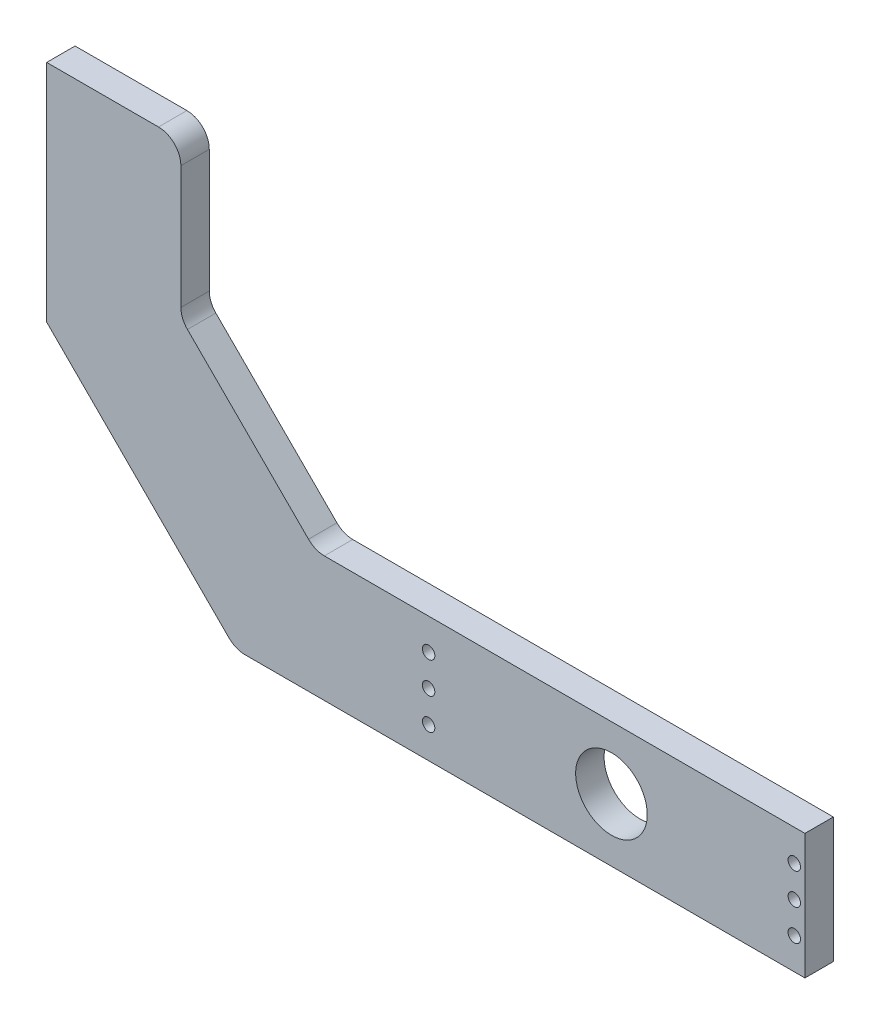
from build123d import *

# Parameters (mm, degrees)
RESSALTO_EXTRUS_O1_DEPTH = 12.7
CIRCULO_ROLAMENTO_REACH  = 245.52
ESBO_O3_R                = 16
ESBO_O6_R                = 2.5
CORTE_EXTRUS_O4_DEPTH    = 30
CORTE_EXTRUS_O6_REACH    = 245.52
CORTE_EXTRUS_O7_REACH    = 245.52
ESBO_O10_R               = 2.78
CORTE_EXTRUS_O8_REACH    = 245.52
ESBO_O12_R               = 2.78
FILETE1_R                = 10


with BuildPart() as part:
    # Esboço1 → Ressalto-extrusão1 (new body)
    with BuildSketch(Plane.XY):
        Polygon((-114.28595772, -92.023971813), (224.71404228, -92.023971813), (224.71404228, -36.023971813), (5.71404228, -36.023971813), (-54.28595772, 23.976028187), (-54.28595772, 92.976028187), (-114.28595772, 92.976028187), align=None)
    extrude(amount=RESSALTO_EXTRUS_O1_DEPTH)

    # Esboço3 → Circulo rolamento (cut, up to next)
    with BuildSketch(Plane.XY.offset(12.7), mode=Mode.PRIVATE) as circulo_rolamento_sk1:
        with Locations((138.21404228, -64.023971813)):
            Circle(ESBO_O3_R)
    circulo_rolamento_tool1 = extrude(circulo_rolamento_sk1.sketch, amount=-CIRCULO_ROLAMENTO_REACH, mode=Mode.PRIVATE) & part.part
    add(circulo_rolamento_tool1.solids().sort_by_distance((138.214042, -64.023972, 12.7))[0], mode=Mode.SUBTRACT)

    # Esboço6 → Corte-extrusão4 (cut)
    with BuildSketch(Plane.ZY.offset(114.28595772)):
        with Locations(Location((7.9, 67.976028187, 0), (0, 0, 270))):
            Circle(ESBO_O6_R)
        with Locations(Location((7.9, 42.976028187, 0), (0, 0, 270))):
            Circle(ESBO_O6_R)
        with Locations(Location((7.9, 17.976028187, 0), (0, 0, 270))):
            Circle(ESBO_O6_R)
    extrude(amount=-CORTE_EXTRUS_O4_DEPTH, mode=Mode.SUBTRACT)

    # Esboço9 → Corte-extrusão6 (cut, up to next)
    with BuildSketch(Plane.XY.offset(12.7), mode=Mode.PRIVATE) as corte_extrus_o6_sk1:
        Polygon((-29.841868762, -92.023971813), (-114.28595772, -7.579882856), (-114.28595772, -92.023971813), align=None)
    corte_extrus_o6_tool1 = extrude(corte_extrus_o6_sk1.sketch, amount=-CORTE_EXTRUS_O6_REACH, mode=Mode.PRIVATE) & part.part
    add(corte_extrus_o6_tool1.solids().sort_by_distance((-86.137928, -63.875942, 12.7))[0], mode=Mode.SUBTRACT)

    # Esboço10 → Corte-extrusão7 (cut, up to next)
    with BuildSketch(Plane.XY.offset(12.7), mode=Mode.PRIVATE) as corte_extrus_o7_sk1:
        with Locations((56.47404228, -50.023971813)):
            Circle(ESBO_O10_R)
    corte_extrus_o7_tool1 = extrude(corte_extrus_o7_sk1.sketch, amount=-CORTE_EXTRUS_O7_REACH, mode=Mode.PRIVATE) & part.part
    # Esboço10 → Corte-extrusão7 (cut, up to next)
    with BuildSketch(Plane.XY.offset(12.7), mode=Mode.PRIVATE) as corte_extrus_o7_sk2:
        with Locations((56.47404228, -64.023971813)):
            Circle(ESBO_O10_R)
    corte_extrus_o7_tool2 = extrude(corte_extrus_o7_sk2.sketch, amount=-CORTE_EXTRUS_O7_REACH, mode=Mode.PRIVATE) & part.part
    # Esboço10 → Corte-extrusão7 (cut, up to next)
    with BuildSketch(Plane.XY.offset(12.7), mode=Mode.PRIVATE) as corte_extrus_o7_sk3:
        with Locations((56.47404228, -78.023971813)):
            Circle(ESBO_O10_R)
    corte_extrus_o7_tool3 = extrude(corte_extrus_o7_sk3.sketch, amount=-CORTE_EXTRUS_O7_REACH, mode=Mode.PRIVATE) & part.part
    add(corte_extrus_o7_tool1.solids().sort_by_distance((56.474042, -50.023972, 12.7))[0], mode=Mode.SUBTRACT)
    add(corte_extrus_o7_tool2.solids().sort_by_distance((56.474042, -64.023972, 12.7))[0], mode=Mode.SUBTRACT)
    add(corte_extrus_o7_tool3.solids().sort_by_distance((56.474042, -78.023972, 12.7))[0], mode=Mode.SUBTRACT)

    # Esboço12 → Corte-extrusão8 (cut, up to next)
    with BuildSketch(Plane.XY.offset(12.7), mode=Mode.PRIVATE) as corte_extrus_o8_sk1:
        with Locations((219.95404228, -78.023971813)):
            Circle(ESBO_O12_R)
    corte_extrus_o8_tool1 = extrude(corte_extrus_o8_sk1.sketch, amount=-CORTE_EXTRUS_O8_REACH, mode=Mode.PRIVATE) & part.part
    # Esboço12 → Corte-extrusão8 (cut, up to next)
    with BuildSketch(Plane.XY.offset(12.7), mode=Mode.PRIVATE) as corte_extrus_o8_sk2:
        with Locations((219.95404228, -64.023971813)):
            Circle(ESBO_O12_R)
    corte_extrus_o8_tool2 = extrude(corte_extrus_o8_sk2.sketch, amount=-CORTE_EXTRUS_O8_REACH, mode=Mode.PRIVATE) & part.part
    # Esboço12 → Corte-extrusão8 (cut, up to next)
    with BuildSketch(Plane.XY.offset(12.7), mode=Mode.PRIVATE) as corte_extrus_o8_sk3:
        with Locations((219.95404228, -50.023971813)):
            Circle(ESBO_O12_R)
    corte_extrus_o8_tool3 = extrude(corte_extrus_o8_sk3.sketch, amount=-CORTE_EXTRUS_O8_REACH, mode=Mode.PRIVATE) & part.part
    add(corte_extrus_o8_tool1.solids().sort_by_distance((219.954042, -78.023972, 12.7))[0], mode=Mode.SUBTRACT)
    add(corte_extrus_o8_tool2.solids().sort_by_distance((219.954042, -64.023972, 12.7))[0], mode=Mode.SUBTRACT)
    add(corte_extrus_o8_tool3.solids().sort_by_distance((219.954042, -50.023972, 12.7))[0], mode=Mode.SUBTRACT)

    # Filete1
    filete1_edges = [part.edges().sort_by_distance(p)[0] for p in [
        (-54.28595772, 92.976028187, 6.35),
        (-54.28595772, 23.976028187, 6.35),
        (5.71404228, -36.023971813, 6.35),
        (-29.841868762, -92.023971813, 6.35),
    ]]
    fillet(filete1_edges, radius=FILETE1_R)


solid = part.part
